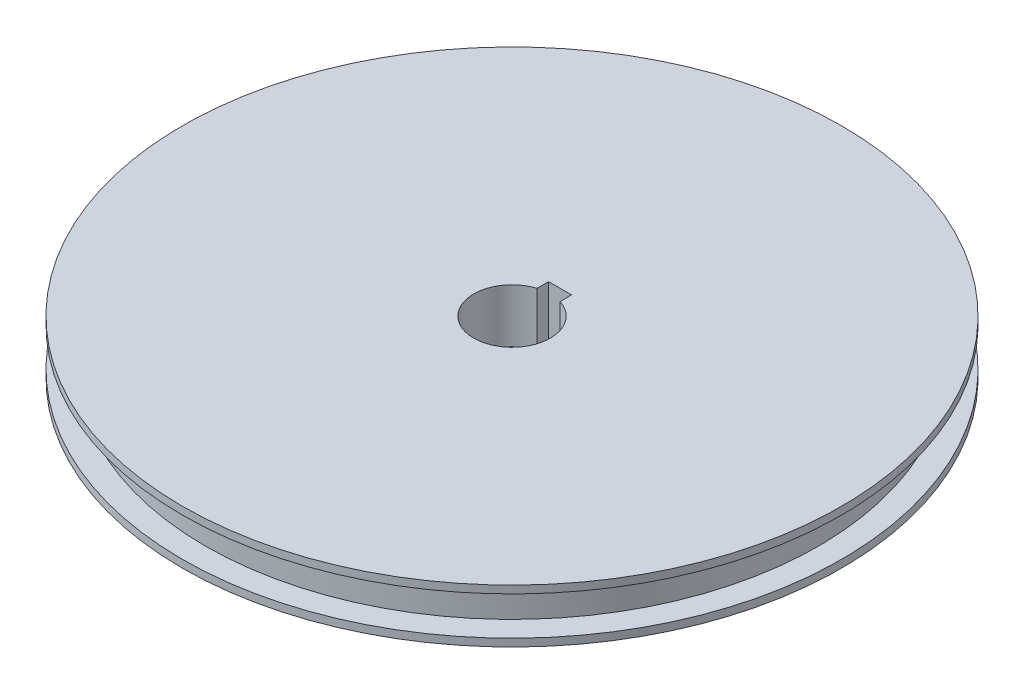
from build123d import *

# Parameters (mm, degrees)
SKETCH1_R           = 40
BOSS_EXTRUDE1_DEPTH = 5
BOSS_EXTRUDE2_START = -1
SKETCH1_3_R         = 43
BOSS_EXTRUDE2_DEPTH = 1
BOSS_EXTRUDE3_START = 5
SKETCH1_4_R         = 43
BOSS_EXTRUDE3_DEPTH = 1


with BuildPart() as part:
    # Sketch1 → Boss-Extrude1 (new body)
    with BuildSketch(Plane(origin=(0, 0, 0), x_dir=(1, 0, 0), z_dir=(0, 1, 0))):
        with Locations(Location((0, 0, 0), (0, 0, 270))):
            Circle(SKETCH1_R)
        with BuildLine():
            ThreePointArc((5, 0), (-2.958039892, -4.031128874), (-1.5, 4.769696007))
            Line((-1.5, 4.769696007), (-1.5, 6.269696007))
            Line((-1.5, 6.269696007), (1.5, 6.269696007))
            Line((1.5, 6.269696007), (1.5, 4.769696007))
            ThreePointArc((1.5, 4.769696007), (4.031128874, 2.958039892), (5, 0))
        make_face(mode=Mode.SUBTRACT)
    extrude(amount=BOSS_EXTRUDE1_DEPTH)

    # Sketch1<3> → Boss-Extrude2 (add)
    with BuildSketch(Plane(origin=(0, 0, 0), x_dir=(1, 0, 0), z_dir=(0, 1, 0)).offset(BOSS_EXTRUDE2_START)):
        with Locations(Location((0, 0, 0), (0, 0, 270))):
            Circle(SKETCH1_3_R)
        with BuildLine():
            Line((-1.5, 4.769696007), (-1.5, 6.269696007))
            Line((-1.5, 6.269696007), (1.5, 6.269696007))
            Line((1.5, 6.269696007), (1.5, 4.769696007))
            ThreePointArc((1.5, 4.769696007), (0, -5), (-1.5, 4.769696007))
        make_face(mode=Mode.SUBTRACT)
    extrude(amount=BOSS_EXTRUDE2_DEPTH)

    # Sketch1<4> → Boss-Extrude3 (add)
    with BuildSketch(Plane(origin=(0, 0, 0), x_dir=(1, 0, 0), z_dir=(0, 1, 0)).offset(BOSS_EXTRUDE3_START)):
        with Locations(Location((0, 0, 0), (0, 0, 270))):
            Circle(SKETCH1_4_R)
        with BuildLine():
            Line((-1.5, 4.769696007), (-1.5, 6.269696007))
            Line((-1.5, 6.269696007), (1.5, 6.269696007))
            Line((1.5, 6.269696007), (1.5, 4.769696007))
            ThreePointArc((1.5, 4.769696007), (0, -5), (-1.5, 4.769696007))
        make_face(mode=Mode.SUBTRACT)
    extrude(amount=BOSS_EXTRUDE3_DEPTH)


solid = part.part
